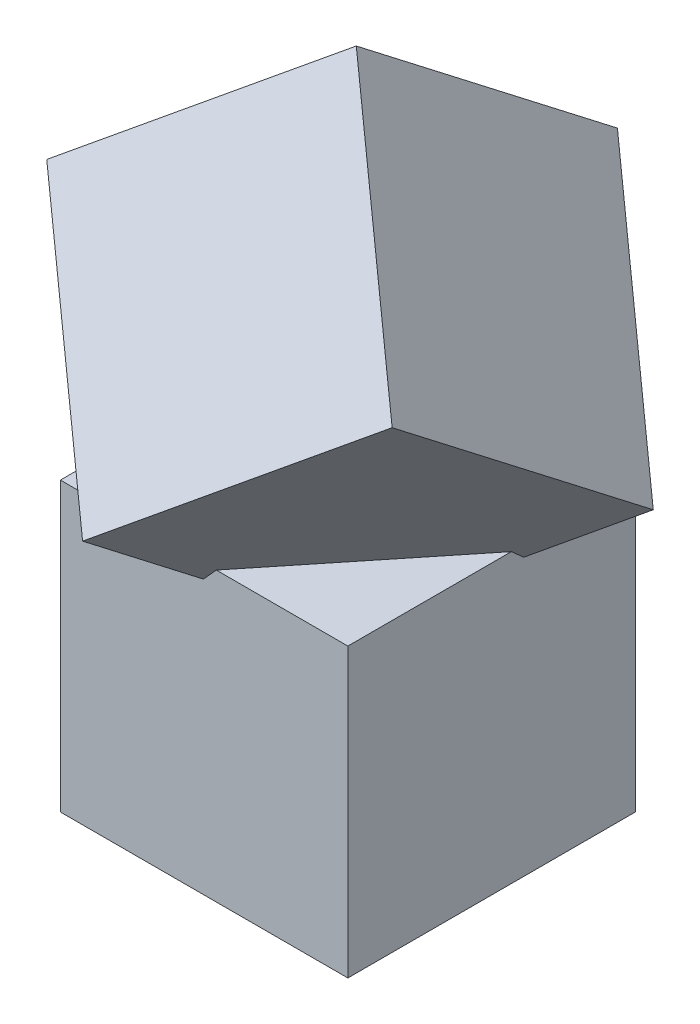
from build123d import *

# Parameters (mm, degrees)
SKETCH1_W             = 76.2
SKETCH1_H             = 76.2
BOSS_EXTRUDE1_DEPTH   = 76.2
BODY_MOVE_COPY1_ANGLE = 55.414104867


with BuildPart() as part:
    # Sketch1 → Boss-Extrude1 (new body)
    with BuildSketch(Plane(origin=(0, 0, 0), x_dir=(1, 0, 0), z_dir=(0, 1, 0))):
        Rectangle(SKETCH1_W, SKETCH1_H)
    extrude(amount=BOSS_EXTRUDE1_DEPTH)


with BuildPart() as body_2:
    # Body-Move/Copy1: copy of part
    add(part.part.moved(Location((0, 0, 0))).rotate(Axis((5.437361952, 44.153662141, -2.520942783), (-0.6710198380109645, 0.12436617590709464, 0.7309346285995654)), BODY_MOVE_COPY1_ANGLE))


with BuildPart() as body_2_1:
    # Body-Move/Copy2: moved
    add(body_2.part.moved(Location((0, 75.090636707, 0))))


solid = Compound([part.part, body_2_1.part])
